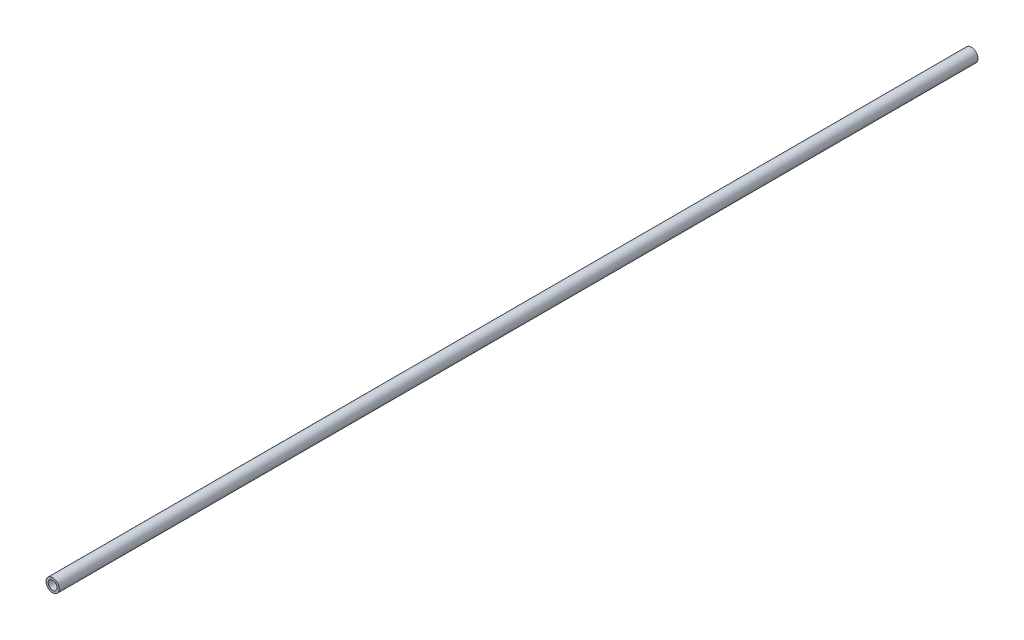
from build123d import *

# Parameters (mm, degrees)
SKETCH1_R           = 3
BOSS_EXTRUDE1_DEPTH = 417.5
SKETCH2_R           = 2
CUT_EXTRUDE1_DEPTH  = 418.52155633


with BuildPart() as part:
    # Sketch1 → Boss-Extrude1 (new body)
    with BuildSketch(Plane.XY):
        Circle(SKETCH1_R)
    extrude(amount=BOSS_EXTRUDE1_DEPTH)

    # Sketch2 → Cut-Extrude1 (cut, through all)
    with BuildSketch(Plane.XY):
        Circle(SKETCH2_R)
    extrude(amount=CUT_EXTRUDE1_DEPTH, mode=Mode.SUBTRACT)


solid = part.part
